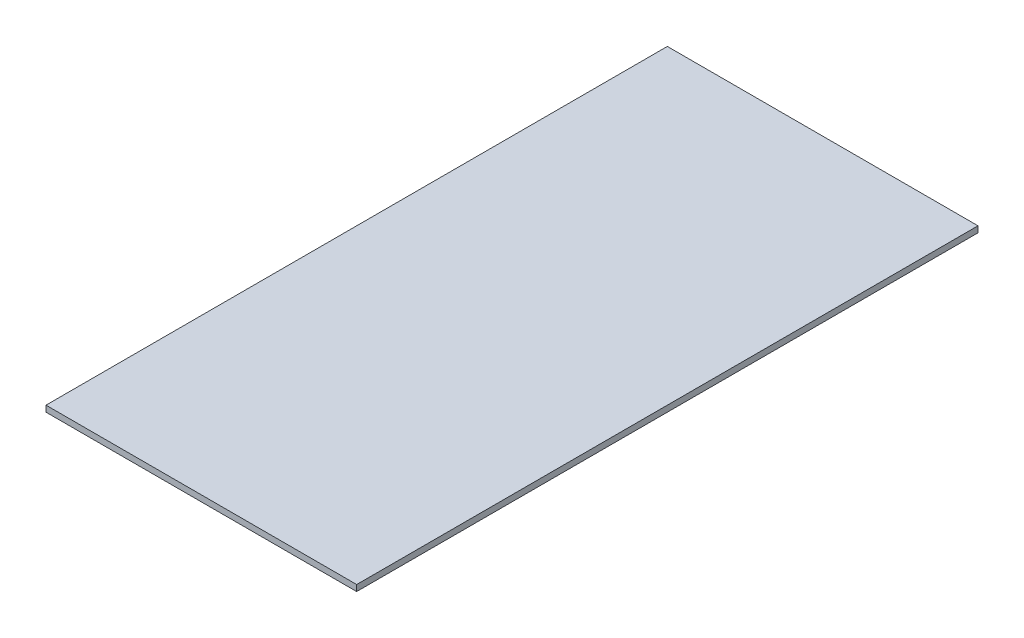
from build123d import *

# Parameters (mm, degrees)
SKETCH1_W           = 50.8
SKETCH1_H           = 101.6
BOSS_EXTRUDE1_DEPTH = 1


with BuildPart() as part:
    # Sketch1 → Boss-Extrude1 (new body)
    with BuildSketch(Plane(origin=(0, 0, 0), x_dir=(1, 0, 0), z_dir=(0, 1, 0))):
        Rectangle(SKETCH1_W, SKETCH1_H)
    extrude(amount=BOSS_EXTRUDE1_DEPTH)


solid = part.part
